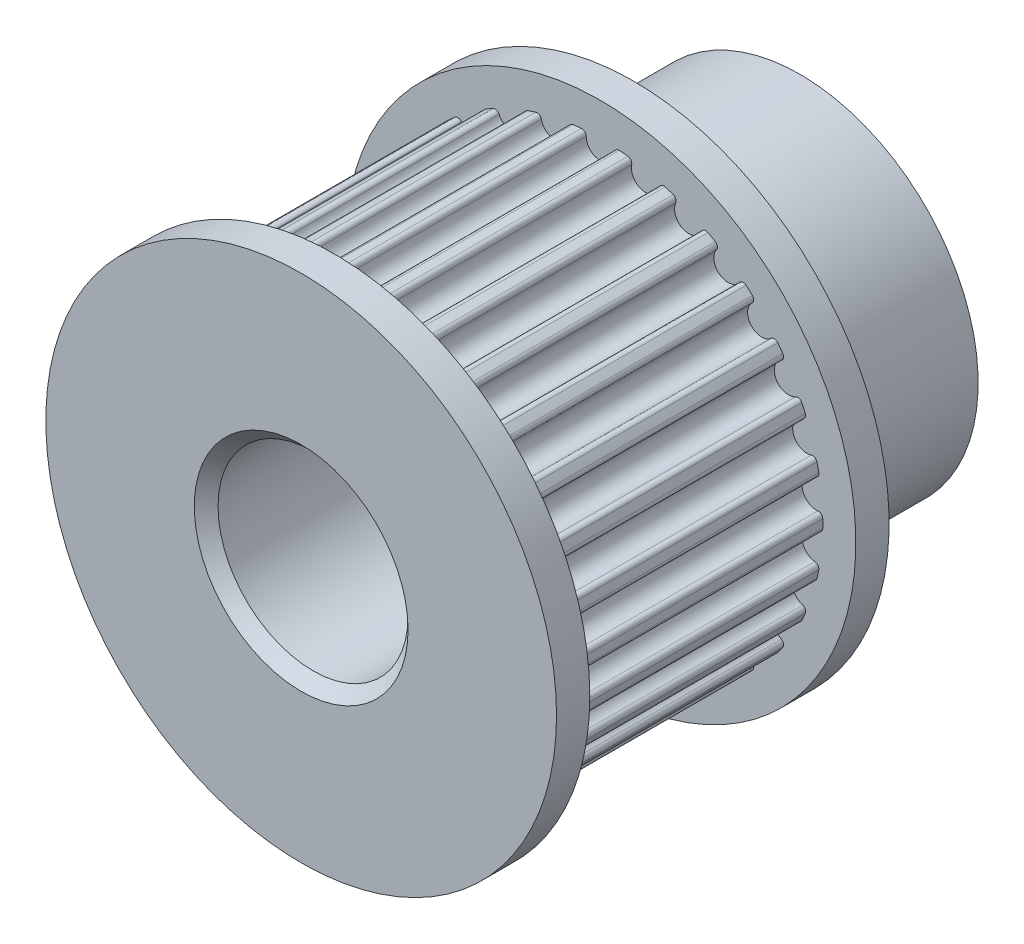
from build123d import *

# Parameters (mm, degrees)
SKETCHREVOLVEGEARBELT01_W       = 11.2
SKETCHREVOLVEGEARBELT01_H       = 9.358796445
TOOTHEXTRUDECUTGEARBELT01_DEPTH = 5.6
PATTERNGEARBELT01_COUNT         = 30
SKETCH5_R                       = 10.75
BOSS_EXTRUDE1_DEPTH             = 1.4
BOSS_EXTRUDE2_START             = 1.4
SKETCH6_R                       = 10.75
BOSS_EXTRUDE2_DEPTH             = 1.4
SKETCH7_R                       = 7.5
BOSS_EXTRUDE3_DEPTH             = 7
SKETCH8_R                       = 4
CUT_EXTRUDE2_DEPTH              = 26.925373671
CHAMFER1_SIZE                   = 0.5


with BuildPart() as part:
    # SketchRevolveGearBelt01 → GearBelt01 (revolve)
    with BuildSketch(Plane(origin=(0, 0, 0), x_dir=(0, 0, -1), z_dir=(1, 0, 0))):
        with Locations((0, 4.679398223)):
            Rectangle(SKETCHREVOLVEGEARBELT01_W, SKETCHREVOLVEGEARBELT01_H)
    revolve(axis=Axis((0, 0, 0), (0, 0, -1)))

    # SketchToothGearBelt01 → ToothExtrudeCutGearBelt01 (cut, symmetric)
    with BuildSketch(Plane.XY):
        with BuildLine():
            Line((-0.801188335, 9.324439294), (0, 11.898796407))
            Line((0, 11.898796407), (0.801188335, 9.324439294))
            ThreePointArc((0.801188335, 9.324439294), (0.660014555, 9.276333742), (0.599999991, 9.139796448))
            ThreePointArc((0.599999991, 9.139796448), (0, 8.539796457), (-0.599999991, 9.139796448))
            ThreePointArc((-0.599999991, 9.139796448), (-0.660014555, 9.276333742), (-0.801188335, 9.324439294))
        make_face()
    toothextrudecutgearbelt01 = extrude(amount=TOOTHEXTRUDECUTGEARBELT01_DEPTH, both=True, mode=Mode.SUBTRACT)

    # PatternGearBelt01: ToothExtrudeCutGearBelt01 ×30 about axis
    patterngearbelt01_axis = Axis((0, 0, 55), (0, 0, -1))
    for i in range(1, PATTERNGEARBELT01_COUNT):
        add(toothextrudecutgearbelt01.rotate(patterngearbelt01_axis, i * 360 / PATTERNGEARBELT01_COUNT), mode=Mode.SUBTRACT)

    # Sketch5 → Boss-Extrude1 (add)
    with BuildSketch(Plane.XY.offset(5.6)):
        Circle(SKETCH5_R)
    extrude(amount=BOSS_EXTRUDE1_DEPTH)

    # Sketch6 → Boss-Extrude2 (add)
    with BuildSketch(Plane(origin=(0, 0, -5.6), x_dir=(-1, 0, 0), z_dir=(0, 0, -1)).offset(BOSS_EXTRUDE2_START)):
        Circle(SKETCH6_R)
    extrude(amount=-BOSS_EXTRUDE2_DEPTH)

    # Sketch7 → Boss-Extrude3 (add)
    with BuildSketch(Plane(origin=(0, 0, -7), x_dir=(-1, 0, 0), z_dir=(0, 0, -1))):
        Circle(SKETCH7_R)
    extrude(amount=BOSS_EXTRUDE3_DEPTH)

    # Sketch8 → Cut-Extrude2 (cut, through all)
    with BuildSketch(Plane(origin=(0, 0, -14), x_dir=(-1, 0, 0), z_dir=(0, 0, -1))):
        Circle(SKETCH8_R)
    extrude(amount=-CUT_EXTRUDE2_DEPTH, mode=Mode.SUBTRACT)

    # Chamfer1
    chamfer1_edges = [part.edges().sort_by_distance(p)[0] for p in [
        (4, 0, -14),
        (4, 0, 7),
    ]]
    chamfer(chamfer1_edges, length=CHAMFER1_SIZE)


solid = part.part
